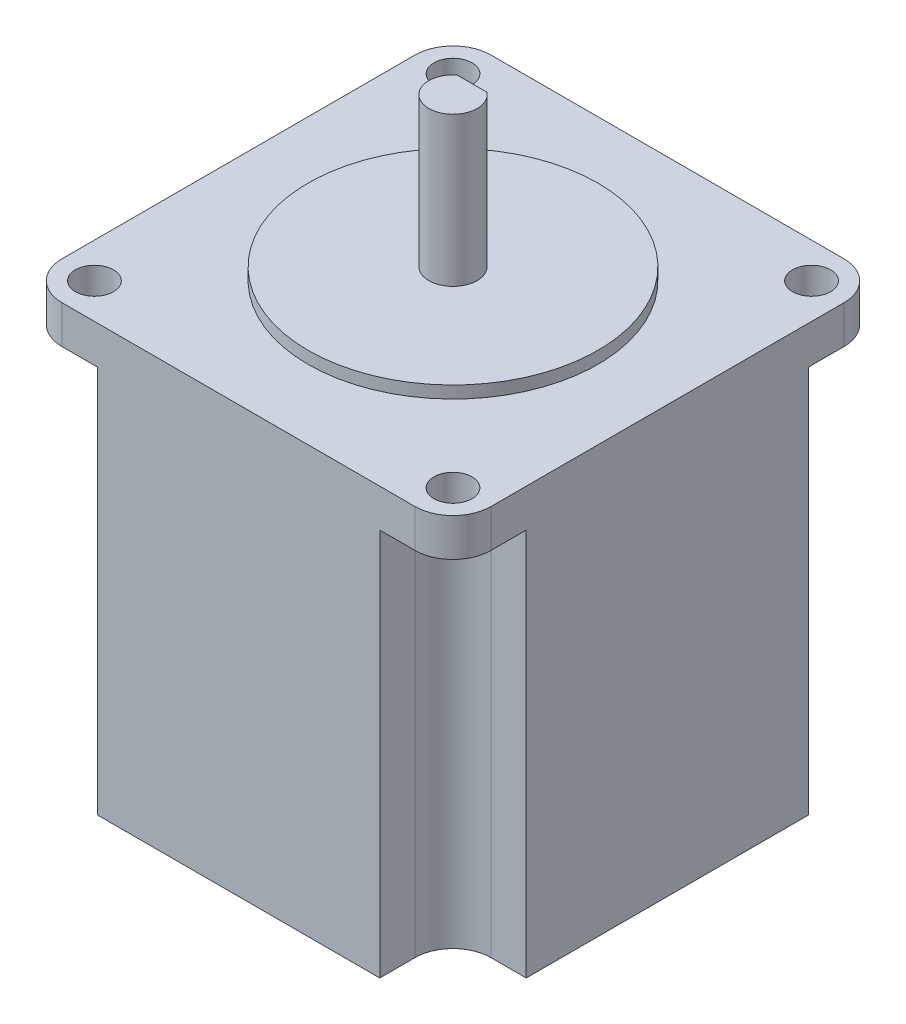
from build123d import *

# Parameters (mm, degrees)
SKETCH1_W           = 56.4
SKETCH1_H           = 56.4
BOSS_EXTRUDE1_DEPTH = 56
SKETCH2_R           = 2.5
CUT_EXTRUDE1_DEPTH  = 56
CUT_EXTRUDE2_DEPTH  = 51
FILLET1_R           = 5
SKETCH5_R           = 19.05
BOSS_EXTRUDE2_DEPTH = 1.6
SKETCH6_R           = 3.175
BOSS_EXTRUDE3_DEPTH = 19.6
CUT_EXTRUDE3_START  = -17
CUT_EXTRUDE3_DEPTH  = 17


with BuildPart() as part:
    # Sketch1 → Boss-Extrude1 (new body)
    with BuildSketch(Plane(origin=(0, 0, 0), x_dir=(1, 0, 0), z_dir=(0, 1, 0))):
        Rectangle(SKETCH1_W, SKETCH1_H)
    extrude(amount=BOSS_EXTRUDE1_DEPTH)

    # Sketch2 → Cut-Extrude1 (cut)
    with BuildSketch(Plane(origin=(0, 56, 0), x_dir=(1, 0, 0), z_dir=(0, 1, 0))):
        with Locations(Location((-23.57, 23.57, 0), (0, 0, 270))):
            Circle(SKETCH2_R)
        with Locations(Location((23.57, 23.57, 0), (0, 0, 270))):
            Circle(SKETCH2_R)
        with Locations(Location((23.57, -23.57, 0), (0, 0, 270))):
            Circle(SKETCH2_R)
        with Locations(Location((-23.57, -23.57, 0), (0, 0, 270))):
            Circle(SKETCH2_R)
    extrude(amount=-CUT_EXTRUDE1_DEPTH, mode=Mode.SUBTRACT)

    # Sketch4 → Cut-Extrude2 (cut)
    with BuildSketch(Plane.XZ):
        with BuildLine():
            Line((-18.57, 23.57), (-18.57, 28.2))
            Line((-18.57, 28.2), (-28.2, 28.2))
            Line((-28.2, 28.2), (-28.2, 18.57))
            Line((-28.2, 18.57), (-23.57, 18.57))
            ThreePointArc((-23.57, 18.57), (-20.034466094, 20.034466094), (-18.57, 23.57))
        make_face()
        with BuildLine():
            Line((23.57, 18.57), (28.2, 18.57))
            Line((28.2, 18.57), (28.2, 28.2))
            Line((28.2, 28.2), (18.57, 28.2))
            Line((18.57, 28.2), (18.57, 23.57))
            ThreePointArc((18.57, 23.57), (20.034466094, 20.034466094), (23.57, 18.57))
        make_face()
        with BuildLine():
            Line((18.57, -23.57), (18.57, -28.2))
            Line((18.57, -28.2), (28.2, -28.2))
            Line((28.2, -28.2), (28.2, -18.57))
            Line((28.2, -18.57), (23.57, -18.57))
            ThreePointArc((23.57, -18.57), (20.034466094, -20.034466094), (18.57, -23.57))
        make_face()
        with BuildLine():
            Line((-23.57, -18.57), (-28.2, -18.57))
            Line((-28.2, -18.57), (-28.2, -28.2))
            Line((-28.2, -28.2), (-18.57, -28.2))
            Line((-18.57, -28.2), (-18.57, -23.57))
            ThreePointArc((-18.57, -23.57), (-20.034466094, -20.034466094), (-23.57, -18.57))
        make_face()
    extrude(amount=-CUT_EXTRUDE2_DEPTH, mode=Mode.SUBTRACT)

    # Fillet1
    fillet1_edges = [part.edges().sort_by_distance(p)[0] for p in [
        (28.2, 53.5, 28.2),
        (-28.2, 53.5, 28.2),
        (-28.2, 53.5, -28.2),
        (28.2, 53.5, -28.2),
    ]]
    fillet(fillet1_edges, radius=FILLET1_R)

    # Sketch5 → Boss-Extrude2 (add)
    with BuildSketch(Plane(origin=(0, 56, 0), x_dir=(1, 0, 0), z_dir=(0, 1, 0))):
        with Locations(Location((0, 0, 0), (0, 0, 90))):
            Circle(SKETCH5_R)
    extrude(amount=BOSS_EXTRUDE2_DEPTH)

    # Sketch6 → Boss-Extrude3 (add)
    with BuildSketch(Plane(origin=(0, 57.6, 0), x_dir=(1, 0, 0), z_dir=(0, 1, 0))):
        with Locations(Location((0, 0, 0), (0, 0, 270))):
            Circle(SKETCH6_R)
    extrude(amount=BOSS_EXTRUDE3_DEPTH)

    # Sketch7 → Cut-Extrude3 (cut)
    with BuildSketch(Plane(origin=(0, 77.2, 0), x_dir=(1, 0, 0), z_dir=(0, 1, 0)).offset(CUT_EXTRUDE3_START)):
        with BuildLine():
            Line((-1.963568181, 2.495), (1.963568181, 2.495))
            ThreePointArc((1.963568181, 2.495), (0, 3.175), (-1.963568181, 2.495))
        make_face()
    extrude(amount=CUT_EXTRUDE3_DEPTH, mode=Mode.SUBTRACT)


solid = part.part
